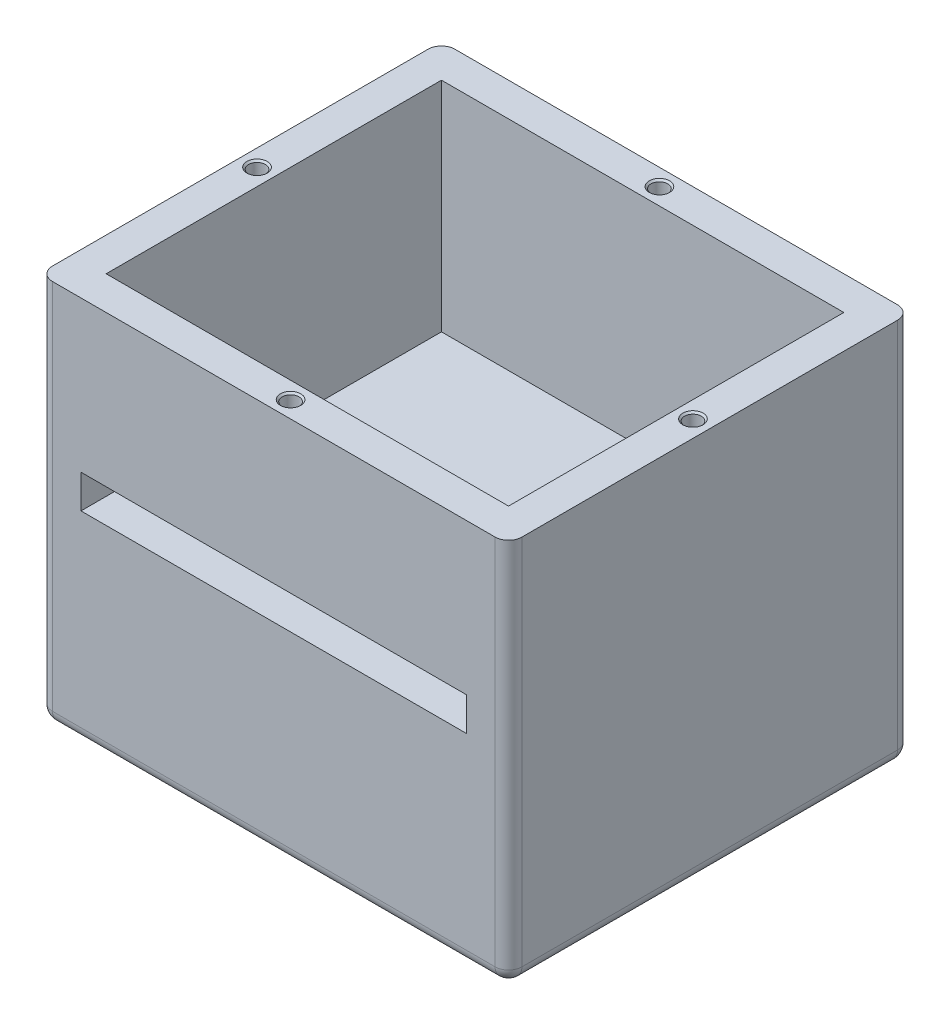
from build123d import *

# Parameters (mm, degrees)
BOX_EXTRUDE_PART_DEPTH         = 110
BOX_EXTRUDE_PART_DEPTH_BACK    = 5
BOX_TOP_VIEW_W                 = 140
BOX_TOP_VIEW_H                 = 120
INNER_BOX_CUT_W                = 120
INNER_BOX_CUT_H                = 100
INNER_BOX_CUT_1_DEPTH          = 65
SCISSOR_CROSSSECTION_W         = 115
SCISSOR_CROSSSECTION_H         = 10
SCISSOR_CORSSSECTION_CUT_DEPTH = 10
SHAFT_LOCATION_R               = 7.5
SHAFT_LOCATION_CUT_DEPTH       = 40
SKETCH2_R                      = 14
BEARING_LOCATION_CUT1_DEPTH    = 10
SKETCH8_R                      = 9.5
BEARING_LOCATION_CUT2_DEPTH    = 35
M6_TAPPED_HOLE3_AT_2_COUNT     = 2
M6_TAPPED_HOLE3_AT_2_PITCH     = 85.14693183
EDGES_FILLET_R                 = 4


with BuildPart() as part:
    # Box_top_view → Box_extrude_part (new, two sides: drawn at the far end of the back side and taken through both)
    with BuildSketch(Plane(origin=(0, 0, 0), x_dir=(1, 0, 0), z_dir=(0, 1, 0)).offset(-BOX_EXTRUDE_PART_DEPTH_BACK)):
        Rectangle(BOX_TOP_VIEW_W, BOX_TOP_VIEW_H)
    extrude(amount=BOX_EXTRUDE_PART_DEPTH + BOX_EXTRUDE_PART_DEPTH_BACK)

    # Inner_box_cut → Inner_box_cut_1 (cut)
    with BuildSketch(Plane(origin=(0, 110, 0), x_dir=(1, 0, 0), z_dir=(0, 1, 0))):
        Rectangle(INNER_BOX_CUT_W, INNER_BOX_CUT_H)
    extrude(amount=-INNER_BOX_CUT_1_DEPTH, mode=Mode.SUBTRACT)

    # Scissor_crossSection → Scissor_corssSection_cut (cut)
    with BuildSketch(Plane.XY.offset(60)):
        with Locations((0, 60)):
            Rectangle(SCISSOR_CROSSSECTION_W, SCISSOR_CROSSSECTION_H)
    extrude(amount=-SCISSOR_CORSSSECTION_CUT_DEPTH, mode=Mode.SUBTRACT)

    # Shaft_location → Shaft_location_cut (cut)
    with BuildSketch(Plane(origin=(0, 45, 0), x_dir=(1, 0, 0), z_dir=(0, 1, 0))):
        with Locations(Location((15, 0, 0), (0, 0, 270))):
            Circle(SHAFT_LOCATION_R)
        with Locations(Location((-15, 0, 0), (0, 0, 90))):
            Circle(SHAFT_LOCATION_R)
    extrude(amount=-SHAFT_LOCATION_CUT_DEPTH, mode=Mode.SUBTRACT)

    # Sketch2 → Bearing_location_cut1 (cut)
    with BuildSketch(Plane(origin=(0, 45, 0), x_dir=(1, 0, 0), z_dir=(0, 1, 0))):
        with Locations(Location((-15, 0, 0), (0, 0, 270))):
            Circle(SKETCH2_R)
        with Locations(Location((15, 0, 0), (0, 0, 90))):
            Circle(SKETCH2_R)
    extrude(amount=-BEARING_LOCATION_CUT1_DEPTH, mode=Mode.SUBTRACT)

    # Sketch8 → Bearing_location_cut2 (cut)
    with BuildSketch(Plane(origin=(0, 45, 0), x_dir=(1, 0, 0), z_dir=(0, 1, 0))):
        with Locations(Location((-15, 0, 0), (0, 0, 270))):
            Circle(SKETCH8_R)
    extrude(amount=-BEARING_LOCATION_CUT2_DEPTH, mode=Mode.SUBTRACT)

    # Sketch7 → M6 Tapped Hole3 (revolve, cut)
    with BuildSketch(Plane(origin=(0, 110, -55), x_dir=(0, 0, 1), z_dir=(1, 0, 0))):
        Polygon((0, 0), (0, 14.502151548), (2.5, 13), (2.5, 0.525), (3.025, 0), align=None)
    m6_tapped_hole3 = revolve(axis=Axis((0, 116.35, -55), (0, -1, 0)), mode=Mode.SUBTRACT)

    # M6 Tapped Hole3 at 2: M6 Tapped Hole3 ×2
    with Locations(*[Vector(-0.7633862853691146, 0, 0.645942241466174) * (i * M6_TAPPED_HOLE3_AT_2_PITCH) for i in range(1, M6_TAPPED_HOLE3_AT_2_COUNT)]):
        add(m6_tapped_hole3, mode=Mode.SUBTRACT)

    # M6_hole_mirror: M6 Tapped Hole3 across plane
    add(m6_tapped_hole3.mirror(Plane(origin=(0, 0, 0), x_dir=(0, 0, 1), z_dir=(1, 0, 0))), mode=Mode.SUBTRACT)

    # M6_hole_mirror copy 1 sketch → M6_hole_mirror copy 1 (revolve, cut)
    with BuildSketch(Plane(origin=(65, 110, 0), x_dir=(0, 0, 1), z_dir=(-1, 0, 0))):
        Polygon((0, 0), (0, -14.502151548), (2.5, -13), (2.5, -0.525), (3.025, 0), align=None)
    revolve(axis=Axis((65, 116.35, 0), (0, 1, 0)), mode=Mode.SUBTRACT)

    # M6_hole_mirror at the second plane: M6 Tapped Hole3 across plane
    add(m6_tapped_hole3.mirror(Plane.XY), mode=Mode.SUBTRACT)

    # M6_hole_mirror at the second plane copy → M6_hole_mirror at the second plane c 2 (revolve, cut)
    with BuildSketch(Plane(origin=(-65, 110, 0), x_dir=(0, 0, -1), z_dir=(1, 0, 0))):
        Polygon((0, 0), (0, -14.502151548), (2.5, -13), (2.5, -0.525), (3.025, 0), align=None)
    revolve(axis=Axis((-65, 116.35, 0), (0, 1, 0)), mode=Mode.SUBTRACT)

    # Edges_fillet
    edges_fillet_edges = [part.edges().sort_by_distance(p)[0] for p in [
        (70, -5, 0),
        (0, -5, -60),
        (-70, -5, 0),
        (-70, 52.5, -60),
        (70, 52.5, -60),
        (70, 52.5, 60),
        (-70, 52.5, 60),
        (0, -5, 60),
    ]]
    fillet(edges_fillet_edges, radius=EDGES_FILLET_R)


solid = part.part
